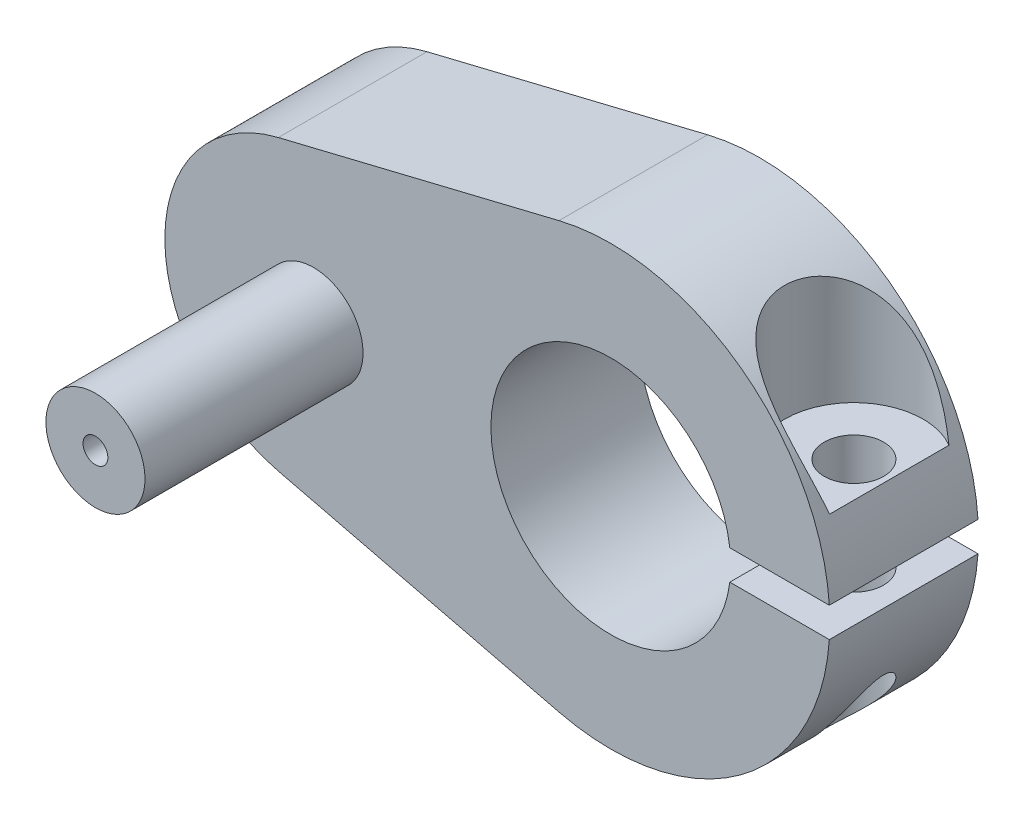
from build123d import *

# Parameters (mm, degrees)
SKETCH1_R               = 6.05
BOSS_EXTRUDE1_DEPTH     = 7.5
SKETCH2_R               = 2.5
BOSS_EXTRUDE2_DEPTH     = 11
CUT_EXTRUDE1_DEPTH      = 0.75
CUT_EXTRUDE1_DEPTH_BACK = 0.75
SKETCH3_W               = 22.1
SKETCH3_H               = 7.5
SKETCH4_R               = 0.625
CUT_EXTRUDE2_DEPTH      = 10
SKETCH5_R               = 3.5
CUT_EXTRUDE3_DEPTH      = 30.219043448
SKETCH6_R               = 1.5
CUT_EXTRUDE4_DEPTH      = 30.219043448


with BuildPart() as part:
    # Sketch1 → Boss-Extrude1 (new body)
    with BuildSketch(Plane.XY):
        with BuildLine():
            Line((-2.615166667, 10.736079513), (-16.775, 7.286931796))
            ThreePointArc((-16.775, 7.286931796), (-22.5, 0), (-16.775, -7.286931796))
            Line((-16.775, -7.286931796), (-2.615166667, -10.736079513))
            ThreePointArc((-2.615166667, -10.736079513), (11.05, 0), (-2.615166667, 10.736079513))
        make_face()
        Circle(SKETCH1_R, mode=Mode.SUBTRACT)
    extrude(amount=-BOSS_EXTRUDE1_DEPTH)

    # Sketch2 → Boss-Extrude2 (add)
    with BuildSketch(Plane.XY):
        with Locations((-15, 0)):
            Circle(SKETCH2_R)
    extrude(amount=BOSS_EXTRUDE2_DEPTH)

    # Sketch3 → Cut-Extrude1 (cut, two sides: drawn at the far end of the back side and taken through both)
    with BuildSketch(Plane(origin=(0, 0, 0), x_dir=(1, 0, 0), z_dir=(0, 1, 0)).offset(-CUT_EXTRUDE1_DEPTH_BACK)):
        with Locations((11.05, 3.75)):
            Rectangle(SKETCH3_W, SKETCH3_H)
    extrude(amount=CUT_EXTRUDE1_DEPTH + CUT_EXTRUDE1_DEPTH_BACK, mode=Mode.SUBTRACT)

    # Sketch4 → Cut-Extrude2 (cut)
    with BuildSketch(Plane.XY.offset(11)):
        with Locations((-15, 0)):
            Circle(SKETCH4_R)
    extrude(amount=-CUT_EXTRUDE2_DEPTH, mode=Mode.SUBTRACT)

    # Sketch5 → Cut-Extrude3 (cut, through all)
    with BuildSketch(Plane(origin=(0, 4, 0), x_dir=(1, 0, 0), z_dir=(0, 1, 0))):
        with Locations((8.513925269, 3.75)):
            Circle(SKETCH5_R)
    extrude(amount=CUT_EXTRUDE3_DEPTH, mode=Mode.SUBTRACT)

    # Sketch6 → Cut-Extrude4 (cut, through all)
    with BuildSketch(Plane(origin=(0, 4, 0), x_dir=(1, 0, 0), z_dir=(0, 1, 0))):
        with Locations((8.513925269, 3.75)):
            Circle(SKETCH6_R)
    extrude(amount=-CUT_EXTRUDE4_DEPTH, mode=Mode.SUBTRACT)


solid = part.part
